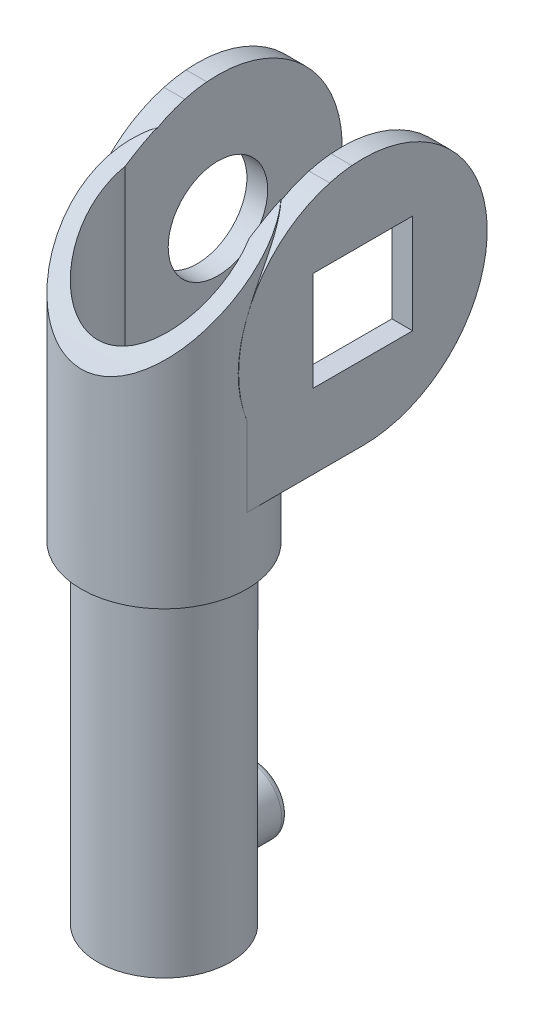
from build123d import *
from build123d.topology import SkipClean

# Parameters (mm, degrees)
SKETCH1_R                       = 5
SKETCH1_R_2                     = 3
BOSS_EXTRUDE1_DEPTH             = 3
SKETCH2_R                       = 5
SKETCH2_R_2                     = 4
BOSS_EXTRUDE2_DEPTH             = 16
BOSS_EXTRUDE3_DEPTH             = 10
CUT_EXTRUDE1_DEPTH              = 16
SKETCH5_R                       = 4
CUT_EXTRUDE2_DEPTH              = 18
CUT_EXTRUDE3_DEPTH              = 30
SKETCH8_W                       = 6
SKETCH8_H                       = 6
CUT_EXTRUDE4_DEPTH              = 7
SKETCH9_R                       = 3
CUT_EXTRUDE5_DEPTH              = 7
BOSS_EXTRUDE4_START             = 20
SKETCH10_R                      = 4
SKETCH10_R_2                    = 3
BOSS_EXTRUDE4_DEPTH             = 20
BOSS_EXTRUDE5_REACH             = 25.135
BOSS_EXTRUDE5_END_RADIUS        = 4
SKETCH11_R                      = 2
BOSS_EXTRUDE5_DIRECTION_2_DEPTH = 1.5
FILLET1_R                       = 0.4


with BuildPart() as part:
    # Sketch1 → Boss-Extrude1 (new body)
    with BuildSketch(Plane(origin=(0, 0, 0), x_dir=(1, 0, 0), z_dir=(0, 1, 0))):
        Circle(SKETCH1_R)
        Circle(SKETCH1_R_2, mode=Mode.SUBTRACT)
    extrude(amount=BOSS_EXTRUDE1_DEPTH)

    # Sketch2 → Boss-Extrude2 (add)
    with BuildSketch(Plane(origin=(0, 3, 0), x_dir=(1, 0, 0), z_dir=(0, 1, 0))):
        Circle(SKETCH2_R)
        Circle(SKETCH2_R_2, mode=Mode.SUBTRACT)
    extrude(amount=BOSS_EXTRUDE2_DEPTH)

    # Sketch3 → Boss-Extrude3 (add)
    with BuildSketch(Plane(origin=(5, 0, 0), x_dir=(0, 0, -1), z_dir=(1, 0, 0))):
        with BuildLine():
            Line((7, 4), (0, 4))
            Line((0, 4), (0, 8.807417596))
            ThreePointArc((0, 8.807417596), (11.245917567, 17.68240924), (7, 4))
        make_face()
    extrude(amount=-BOSS_EXTRUDE3_DEPTH)

    # Sketch4 → Cut-Extrude1 (cut)
    with BuildSketch(Plane(origin=(5, 0, 0), x_dir=(0, 0, -1), z_dir=(1, 0, 0))):
        with BuildLine():
            Line((-5, 11.5), (-9.7286492, 16.2286492))
            Line((-9.7286492, 16.2286492), (-5.44277466, 22.641996471))
            Line((-5.44277466, 22.641996471), (7, 19))
            add(Edge.make_bspline(
                [(7, 19), (6.318131306, 19.000028418), (1.657993515, 18.351162216), (-3.360726674, 13.19986781), (-5, 11.5)],
                knots=[0, 0, 0, 0, 0.141151098, 1, 1, 1, 1], degree=3))
        make_face()
    extrude(amount=-CUT_EXTRUDE1_DEPTH, mode=Mode.SUBTRACT)

    # Sketch5 → Cut-Extrude2 (cut)
    with BuildSketch(Plane(origin=(0, 3, 0), x_dir=(1, 0, 0), z_dir=(0, 1, 0))):
        Circle(SKETCH5_R)
    extrude(amount=CUT_EXTRUDE2_DEPTH, mode=Mode.SUBTRACT)

    # Sketch7 → Cut-Extrude3 (cut)
    with BuildSketch(Plane(origin=(0, 3, 0), x_dir=(1, 0, 0), z_dir=(0, 1, 0))):
        Polygon((0, 0), (-3.75, 0), (-3.75, 16.160631513), (3.75, 16.160631513), (3.75, 0), align=None)
    extrude(amount=CUT_EXTRUDE3_DEPTH, mode=Mode.SUBTRACT)

    # Sketch8 → Cut-Extrude4 (cut)
    with BuildSketch(Plane(origin=(5, 0, 0), x_dir=(0, 0, -1), z_dir=(1, 0, 0))):
        with Locations((7, 11.5)):
            Rectangle(SKETCH8_W, SKETCH8_H)
    extrude(amount=-CUT_EXTRUDE4_DEPTH, mode=Mode.SUBTRACT)

    # Sketch9 → Cut-Extrude5 (cut)
    with BuildSketch(Plane.ZY.offset(5)):
        with Locations((-7, 11.5)):
            Circle(SKETCH9_R)
    extrude(amount=-CUT_EXTRUDE5_DEPTH, mode=Mode.SUBTRACT)

    # Sketch10 → Boss-Extrude4 (add)
    with BuildSketch(Plane.XZ.offset(BOSS_EXTRUDE4_START)):
        Circle(SKETCH10_R)
        Circle(SKETCH10_R_2, mode=Mode.SUBTRACT)
    extrude(amount=-BOSS_EXTRUDE4_DEPTH)

    # Boss-Extrude5: up to this cylinder (the profile starts outside it)
    boss_extrude5_end = Plane(origin=(0, -16, 0), z_dir=(0, 1, 0)) * Cylinder(BOSS_EXTRUDE5_END_RADIUS, 59.27, mode=Mode.PRIVATE)
    # Sketch11 → Boss-Extrude5 (add, up to the surface)
    with BuildSketch(Plane.XY.offset(-4), mode=Mode.PRIVATE) as boss_extrude5_sk1:
        with Locations((0, -16)):
            Circle(SKETCH11_R)
    boss_extrude5_tool1 = extrude(boss_extrude5_sk1.sketch, amount=BOSS_EXTRUDE5_REACH, mode=Mode.PRIVATE) - boss_extrude5_end
    add(boss_extrude5_tool1.solids().sort_by_distance((0, -16, -4))[0])
    add(boss_extrude5_tool1.solids().sort_by_distance((0, -16, -4))[1])

    # Sketch11 → Boss-Extrude5 direction 2 (add)
    with SkipClean():  # the faces are left unmerged after this step: merging them gives an invalid solid
        with BuildSketch(Plane.XY.offset(-4)):
            with Locations((0, -16)):
                Circle(SKETCH11_R)
        extrude(amount=-BOSS_EXTRUDE5_DIRECTION_2_DEPTH)
    add(part.part.scale(1), mode=Mode.REPLACE)  # the faces are merged on a copy

    # Fillet1
    fillet1_edges = [part.edges().sort_by_distance(p)[0] for p in [
        (-2, -16, -5.5),
    ]]
    fillet(fillet1_edges, radius=FILLET1_R)


solid = part.part
